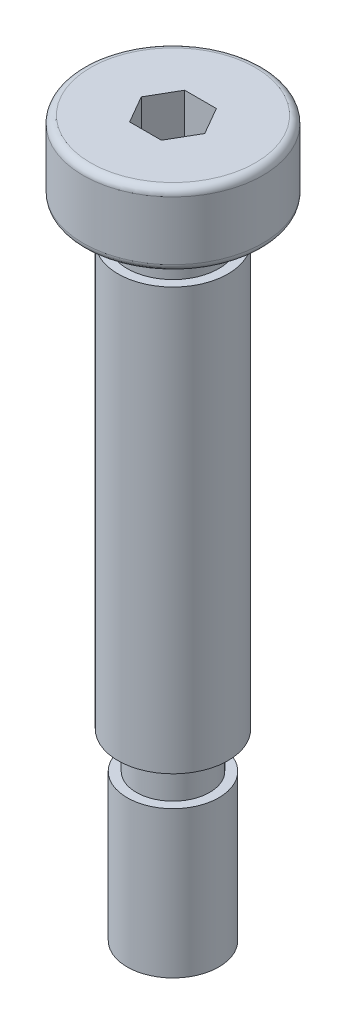
from build123d import *

# Parameters (mm, degrees)
CUT_EXTRUDE_1_DEPTH = 3.5


with BuildPart() as part:
    # 草图1 → 旋转1 (revolve)
    with BuildSketch(Plane.XY, mode=Mode.PRIVATE) as revolve_1_sk:
        with BuildLine():
            Line((0, 39), (-4.5, 39))
            ThreePointArc((-4.5, 39), (-4.782842712, 38.882842712), (-4.9, 38.6))
            Line((-4.9, 38.6), (-4.9, 35.4))
            ThreePointArc((-4.9, 35.4), (-4.782842712, 35.117157288), (-4.5, 35))
            Line((-4.5, 35), (-2.5, 35))
            Line((-2.5, 35), (-2.5, 33))
            Line((-2.5, 33), (-3, 33))
            Line((-3, 33), (-3, 10))
            Line((-3, 10), (-2, 10))
            Line((-2, 10), (-2, 8))
            Line((-2, 8), (-2.5, 8))
            Line((-2.5, 8), (-2.5, 0))
            Line((-2.5, 0), (0, 0))
            Line((0, 0), (0, 39))
        make_face()
    revolve(revolve_1_sk.sketch.rotate(Axis((0, 0, 0), (0, 1, 0)), 270), axis=Axis((0, 0, 0), (0, 1, 0)))

    # 草图2 → 切除-拉伸1 (cut)
    with BuildSketch(Plane(origin=(0, 39, 0), x_dir=(1, 0, 0), z_dir=(0, 1, 0))):
        Polygon((0.866025404, 1.5), (-0.866025404, 1.5), (-1.732050808, 0), (-0.866025404, -1.5), (0.866025404, -1.5), (1.732050808, 0), align=None)
    extrude(amount=-CUT_EXTRUDE_1_DEPTH, mode=Mode.SUBTRACT)


solid = part.part
